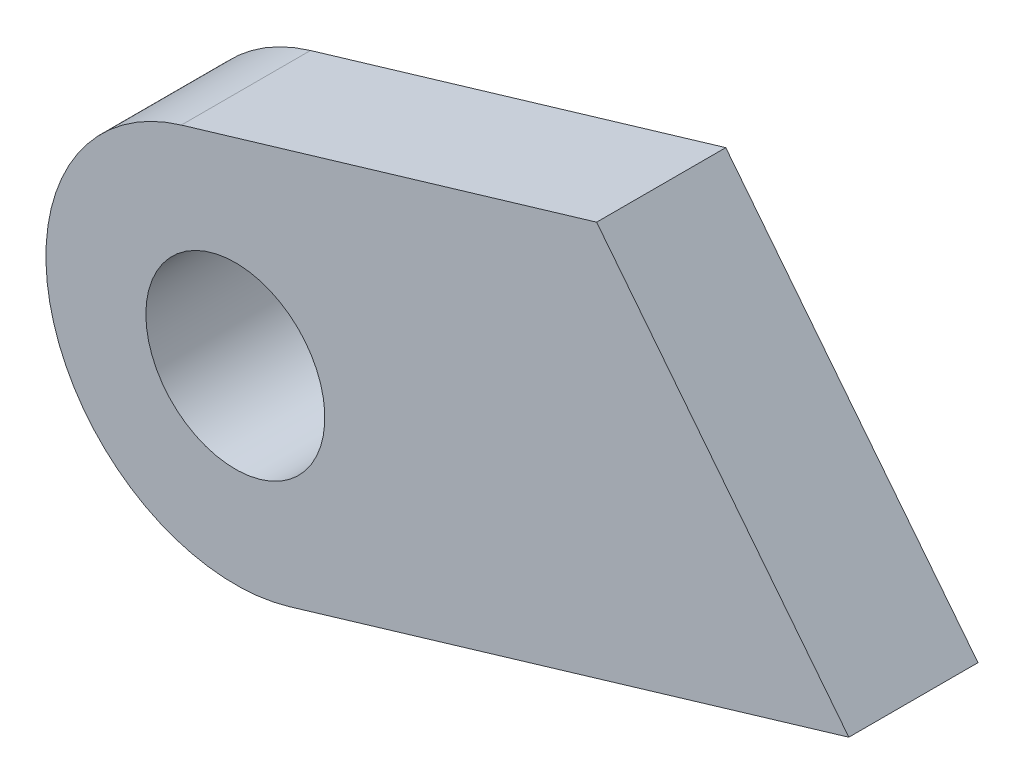
from build123d import *

# Parameters (mm, degrees)
SKETCH1_R           = 3.3
BOSS_EXTRUDE1_DEPTH = 4.7625


with BuildPart() as part:
    # Sketch1 → Boss-Extrude1 (new body)
    with BuildSketch(Plane.XY):
        with BuildLine():
            Line((-508.291723206, -95.594257619), (-487.660025711, -89.447897876))
            Line((-487.660025711, -89.447897876), (-496.962426186, -77.649232083))
            Line((-496.962426186, -77.649232083), (-512.277542982, -82.204928563))
            ThreePointArc((-512.277542982, -82.204928563), (-516.980664668, -90.89290993), (-508.291723206, -95.594257619))
        make_face()
        with Locations(Location((-510.286, -88.9, 0), (0, 0, 180))):
            Circle(SKETCH1_R, mode=Mode.SUBTRACT)
    extrude(amount=BOSS_EXTRUDE1_DEPTH)


solid = part.part
